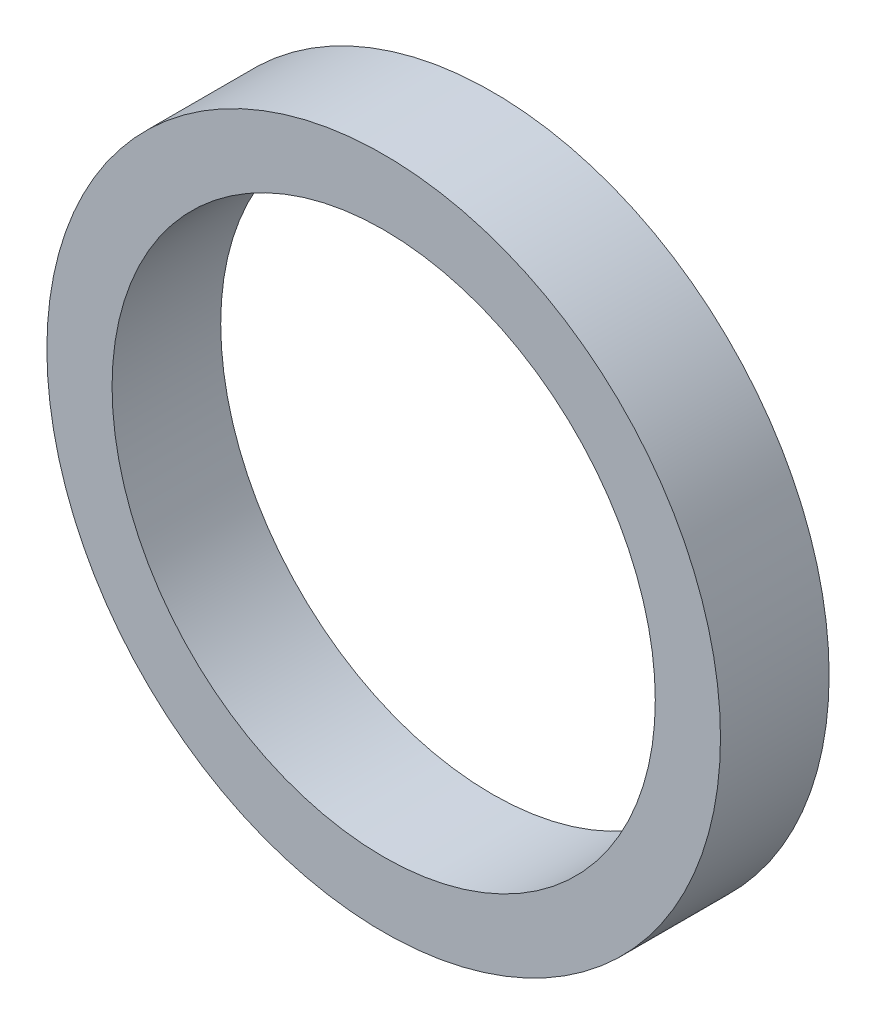
from build123d import *

# Parameters (mm, degrees)
SKETCH_1_R      = 15.5
SKETCH_1_R_2    = 12.5
EXTRUDE_1_DEPTH = 5


with BuildPart() as part:
    # 草图1 → 凸台-拉伸1 (new body)
    with BuildSketch(Plane.XY):
        Circle(SKETCH_1_R)
        Circle(SKETCH_1_R_2, mode=Mode.SUBTRACT)
    extrude(amount=EXTRUDE_1_DEPTH)


solid = part.part
